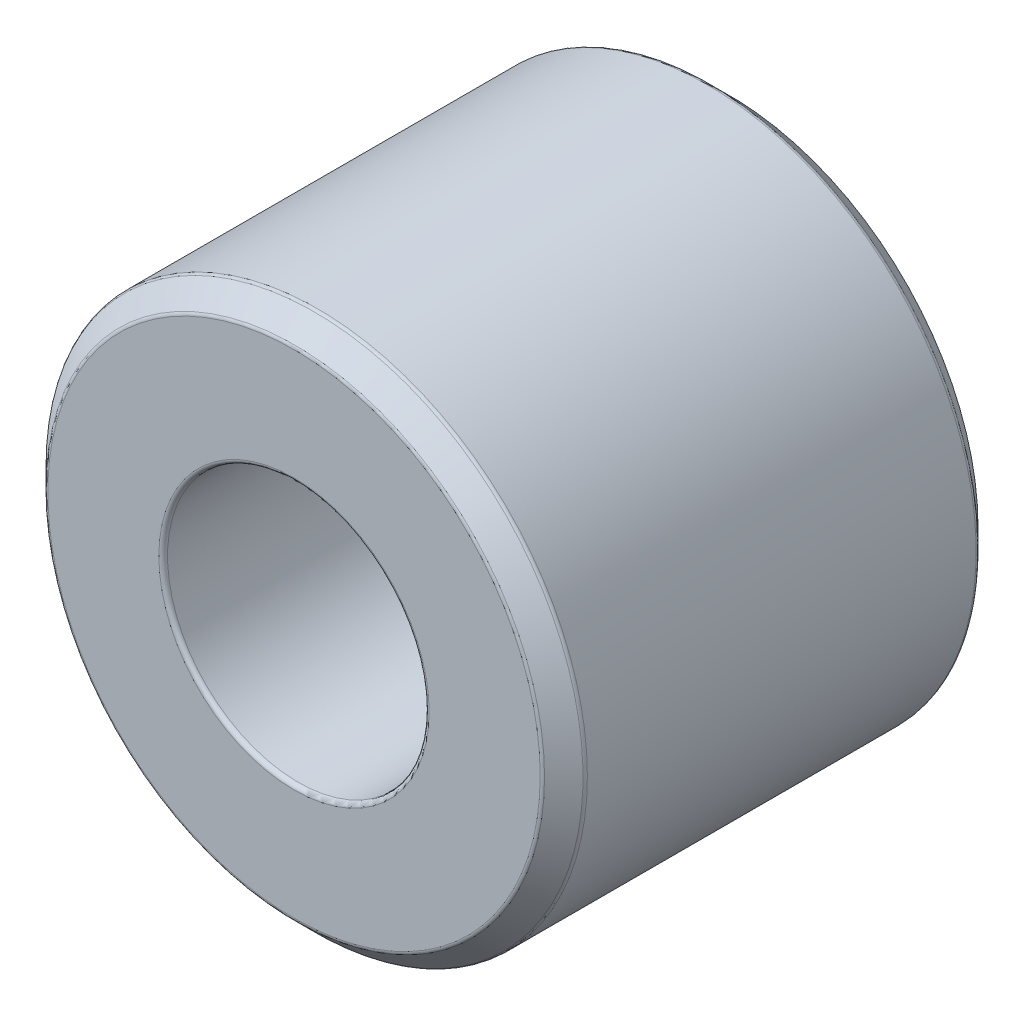
from build123d import *

# Parameters (mm, degrees)
SKETCH1_R           = 6.187725479
SKETCH1_R_2         = 3
BOSS_EXTRUDE1_DEPTH = 10
FILLET1_R           = 0.1
CHAMFER1_SIZE       = 0.5
FILLET3_R           = 0.1


with BuildPart() as part:
    # Sketch1 → Boss-Extrude1 (new body)
    with BuildSketch(Plane.XY):
        Circle(SKETCH1_R)
        Circle(SKETCH1_R_2, mode=Mode.SUBTRACT)
    extrude(amount=BOSS_EXTRUDE1_DEPTH)

    # Fillet1
    fillet1_edges = [part.edges().sort_by_distance(p)[0] for p in [
        (-3, 0, 0),
        (-3, 0, 10),
    ]]
    fillet(fillet1_edges, radius=FILLET1_R)

    # Chamfer1
    chamfer1_edges = [part.edges().sort_by_distance(p)[0] for p in [
        (-6.187725479, 0, 0),
        (-6.187725479, 0, 10),
    ]]
    chamfer(chamfer1_edges, length=CHAMFER1_SIZE)

    # Fillet3
    fillet3_edges = [part.edges().sort_by_distance(p)[0] for p in [
        (-6.187725479, 0, 9.5),
        (-6.187725479, 0, 0.5),
        (-5.687725479, 0, 0),
        (-5.687725479, 0, 10),
    ]]
    fillet(fillet3_edges, radius=FILLET3_R)


solid = part.part
